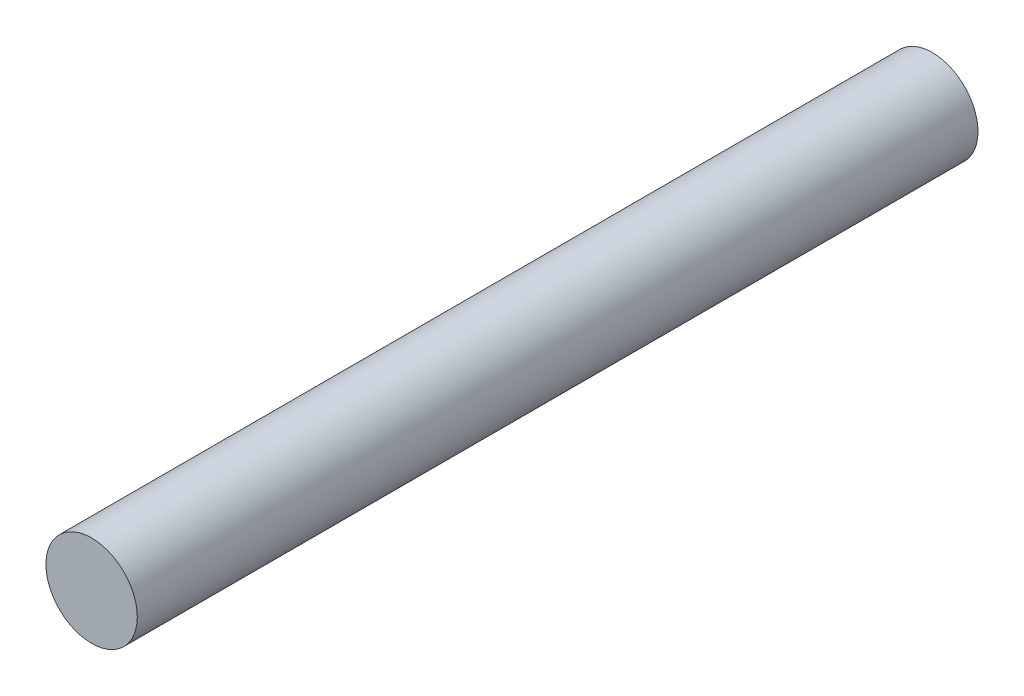
from build123d import *

# Parameters (mm, degrees)
PIVOTSHAFT_SKETCH_R      = 2.5
PIVOTSHAFT_EXTRUDE_DEPTH = 23


with BuildPart() as part:
    # pivotShaft_sketch → pivotShaft_extrude (new, symmetric)
    with BuildSketch(Plane.XY):
        Circle(PIVOTSHAFT_SKETCH_R)
    extrude(amount=PIVOTSHAFT_EXTRUDE_DEPTH, both=True)


solid = part.part
